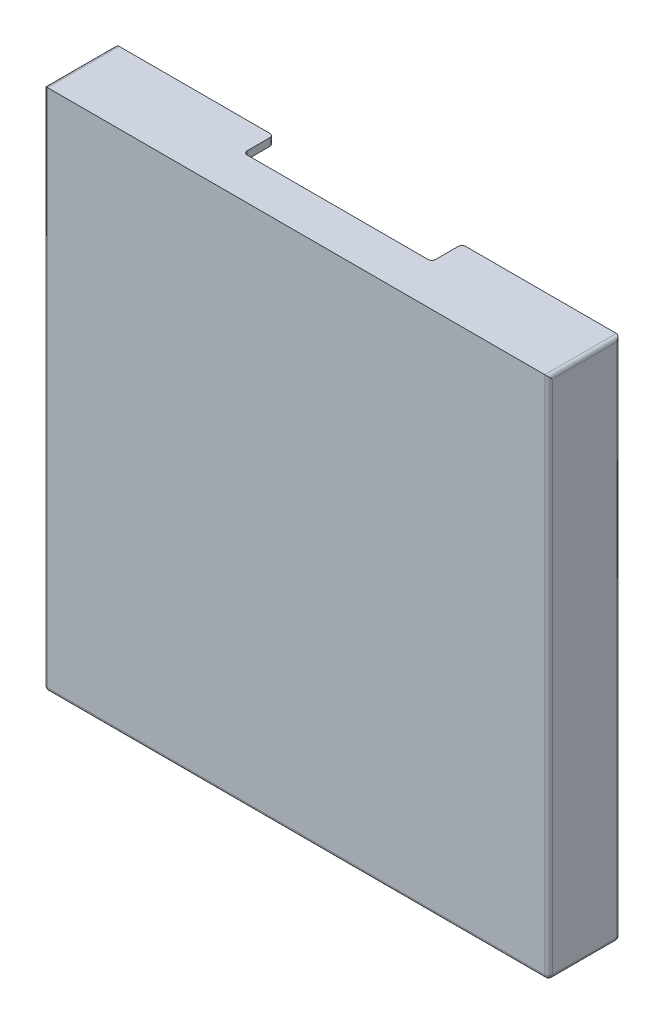
from build123d import *

# Parameters (mm, degrees)
SKETCH_1_W             = 268
SKETCH_1_H             = 38
EXTRUDE_1_DEPTH        = 278
SKETCH_2_W             = 260
SKETCH_2_H             = 270
CUT_EXTRUDE_1_DEPTH    = 36
CUT_EXTRUDE_2_REACH    = 311.194
SKETCH_3_W             = 100
SKETCH_3_H             = 16
FILLET_1_R             = 2
SKETCH_4_W             = 2
SKETCH_4_H             = 270
EXTRUDE_2_DEPTH        = 36
PATTERN_LINEAR_1_COUNT = 3
PATTERN_LINEAR_1_PITCH = 66
SKETCH_5_W             = 260
SKETCH_5_H             = 2
EXTRUDE_3_DEPTH        = 36
CUT_EXTRUDE_4_DEPTH    = 2
FILLET_2_R             = 2
PATTERN_LINEAR_2_COUNT = 3
PATTERN_LINEAR_2_PITCH = 70


with BuildPart() as part:
    # 草图1 → 凸台-拉伸1 (new body)
    with BuildSketch(Plane(origin=(0, 0, 0), x_dir=(1, 0, 0), z_dir=(0, 1, 0))):
        Rectangle(SKETCH_1_W, SKETCH_1_H)
    extrude(amount=EXTRUDE_1_DEPTH)

    # 草图2 → 切除-拉伸1 (cut)
    with BuildSketch(Plane(origin=(0, 0, -19), x_dir=(-1, 0, 0), z_dir=(0, 0, -1))):
        with Locations((0, 139)):
            Rectangle(SKETCH_2_W, SKETCH_2_H)
    extrude(amount=-CUT_EXTRUDE_1_DEPTH, mode=Mode.SUBTRACT)

    # 草图3 → 切除-拉伸2 (cut, up to next)
    with BuildSketch(Plane(origin=(0, 278, 0), x_dir=(1, 0, 0), z_dir=(0, 1, 0)), mode=Mode.PRIVATE) as cut_extrude_2_sk1:
        with Locations((0, 11)):
            Rectangle(SKETCH_3_W, SKETCH_3_H)
    cut_extrude_2_tool1 = extrude(cut_extrude_2_sk1.sketch, amount=-CUT_EXTRUDE_2_REACH, mode=Mode.PRIVATE) & part.part
    add(cut_extrude_2_tool1.solids().sort_by_distance((0, 278, -11))[0], mode=Mode.SUBTRACT)

    # 圆角1
    fillet_1_edges = [part.edges().sort_by_distance(p)[0] for p in [
        (134, 278, 0),
        (-50, 276, -3),
        (-50, 276, -19),
        (50, 276, -19),
        (50, 276, -3),
        (-134, 278, 0),
        (0, 0, -19),
        (134, 0, 0),
        (0, 0, 19),
        (-134, 0, 0),
        (-134, 139, -19),
        (134, 139, -19),
        (134, 139, 19),
        (-134, 139, 19),
    ]]
    fillet(fillet_1_edges, radius=FILLET_1_R)

    # 草图4 → 凸台-拉伸2 (add)
    with BuildSketch(Plane(origin=(0, 0, 17), x_dir=(-1, 0, 0), z_dir=(0, 0, -1))):
        with Locations((-67, 139)):
            Rectangle(SKETCH_4_W, SKETCH_4_H)
    extrude_2 = extrude(amount=EXTRUDE_2_DEPTH)

    # 阵列(线性)1: 凸台-拉伸2 ×3
    with Locations(*[(-i * PATTERN_LINEAR_1_PITCH, 0, 0) for i in range(1, PATTERN_LINEAR_1_COUNT)]):
        add(extrude_2)

    # 草图5 → 凸台-拉伸3 (add)
    with BuildSketch(Plane(origin=(0, 0, 17), x_dir=(-1, 0, 0), z_dir=(0, 0, -1))):
        with Locations((0, 209)):
            Rectangle(SKETCH_5_W, SKETCH_5_H)
    extrude_3 = extrude(amount=EXTRUDE_3_DEPTH)

    # 草图7 → 切除-拉伸4 (cut)
    with BuildSketch(Plane.ZY):
        with BuildLine():
            Line((-19, 274), (-19, 258))
            ThreePointArc((-19, 258), (-7.686291501, 262.686291501), (-3, 274))
            Line((-3, 274), (-19, 274))
        make_face()
    extrude(amount=-CUT_EXTRUDE_4_DEPTH, mode=Mode.SUBTRACT)

    # 圆角2
    fillet_2_edges = [part.edges().sort_by_distance(p)[0] for p in [
        (1, 258, -19),
    ]]
    fillet(fillet_2_edges, radius=FILLET_2_R)

    # 阵列(线性)2: 凸台-拉伸3 ×3
    with Locations(*[(0, -i * PATTERN_LINEAR_2_PITCH, 0) for i in range(1, PATTERN_LINEAR_2_COUNT)]):
        add(extrude_3)


solid = part.part
